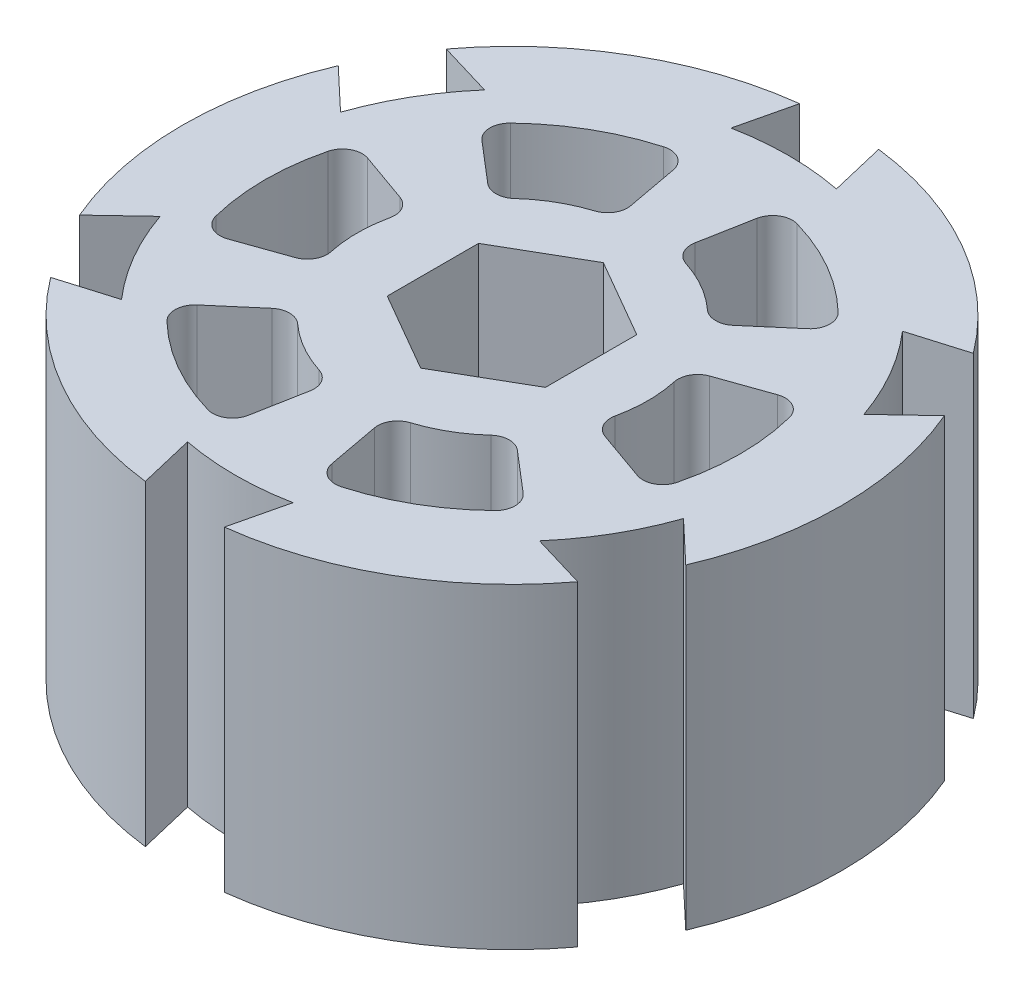
from build123d import *

# Parameters (mm, degrees)
SKETCH1_R           = 25
BOSS_EXTRUDE1_DEPTH = 24
CUT_EXTRUDE3_START  = -2
CUT_EXTRUDE3_DEPTH  = 45.731721238
CIRPATTERN1_COUNT   = 6
CUT_EXTRUDE4_DEPTH  = 24
CIRPATTERN5_COUNT   = 6
CUT_EXTRUDE5_DEPTH  = 18
SKETCH6_R           = 1.9
CUT_EXTRUDE6_DEPTH  = 18


with BuildPart() as part:
    # Sketch1 → Boss-Extrude1 (new body)
    with BuildSketch(Plane(origin=(0, 0, 0), x_dir=(1, 0, 0), z_dir=(0, 1, 0))):
        with Locations(Location((0, 0, 0), (0, 0, 270))):
            Circle(SKETCH1_R)
    extrude(amount=BOSS_EXTRUDE1_DEPTH)

    # Sketch2 → Cut-Extrude3 (cut)
    with BuildSketch(Plane(origin=(0, 0, 0), x_dir=(1, 0, 0), z_dir=(0, 1, 0)).offset(CUT_EXTRUDE3_START)):
        with BuildLine():
            Line((-3, 24.819347292), (-4, 20.615528128))
            ThreePointArc((-4, 20.615528128), (0, 21), (4, 20.615528128))
            Line((4, 20.615528128), (3, 24.819347292))
            ThreePointArc((3, 24.819347292), (0, 25), (-3, 24.819347292))
        make_face()
    cut_extrude3 = extrude(amount=CUT_EXTRUDE3_DEPTH, mode=Mode.SUBTRACT)

    # CirPattern1: Cut-Extrude3 ×6 about axis
    cirpattern1_axis = Axis((0, 0, 0), (0, 1, 0))
    for i in range(1, CIRPATTERN1_COUNT):
        add(cut_extrude3.rotate(cirpattern1_axis, i * 360 / CIRPATTERN1_COUNT), mode=Mode.SUBTRACT)

    # Sketch3 → Cut-Extrude4 (cut)
    with BuildSketch(Plane(origin=(0, 0, 0), x_dir=(1, 0, 0), z_dir=(0, 1, 0))):
        with BuildLine():
            ThreePointArc((7.065480282, 7.767173771), (8.051747799, 7.376947701), (9.04955872, 7.736632793))
            Line((9.04955872, 7.736632793), (12.107901914, 10.351266166))
            ThreePointArc((12.107901914, 10.351266166), (12.632451903, 11.444743237), (12.176913221, 12.568722465))
            ThreePointArc((12.176913221, 12.568722465), (8.75, 15.155444566), (4.796376338, 16.829877422))
            ThreePointArc((4.796376338, 16.829877422), (3.595212432, 16.662395879), (2.910508504, 15.661383727))
            Line((2.910508504, 15.661383727), (2.175341178, 11.705464141))
            ThreePointArc((2.175341178, 11.705464141), (2.362750212, 10.661491989), (3.19382966, 10.0024723))
            ThreePointArc((3.19382966, 10.0024723), (5.25, 9.09326674), (7.065480282, 7.767173771))
        make_face()
    cut_extrude4 = extrude(amount=CUT_EXTRUDE4_DEPTH, mode=Mode.SUBTRACT)

    # CirPattern5: Cut-Extrude4 ×6 about axis
    cirpattern5_axis = Axis((-0.262257429, 0, 0.454243191), (0, 1, 0))
    for i in range(1, CIRPATTERN5_COUNT):
        add(cut_extrude4.rotate(cirpattern5_axis, i * 360 / CIRPATTERN5_COUNT), mode=Mode.SUBTRACT)

    # Sketch5 → Cut-Extrude5 (cut)
    with BuildSketch(Plane(origin=(0, 24, 0), x_dir=(1, 0, 0), z_dir=(0, 1, 0))):
        Polygon((0, 6.92820323), (-6, 3.464101615), (-6, -3.464101615), (0, -6.92820323), (6, -3.464101615), (6, 3.464101615), align=None)
    extrude(amount=-CUT_EXTRUDE5_DEPTH, mode=Mode.SUBTRACT)

    # Sketch6 → Cut-Extrude6 (cut)
    with BuildSketch(Plane(origin=(0, 6, 0), x_dir=(1, 0, 0), z_dir=(0, 1, 0))):
        with Locations(Location((0, 0, 0), (0, 0, 270))):
            Circle(SKETCH6_R)
    extrude(amount=-CUT_EXTRUDE6_DEPTH, mode=Mode.SUBTRACT)


solid = part.part
